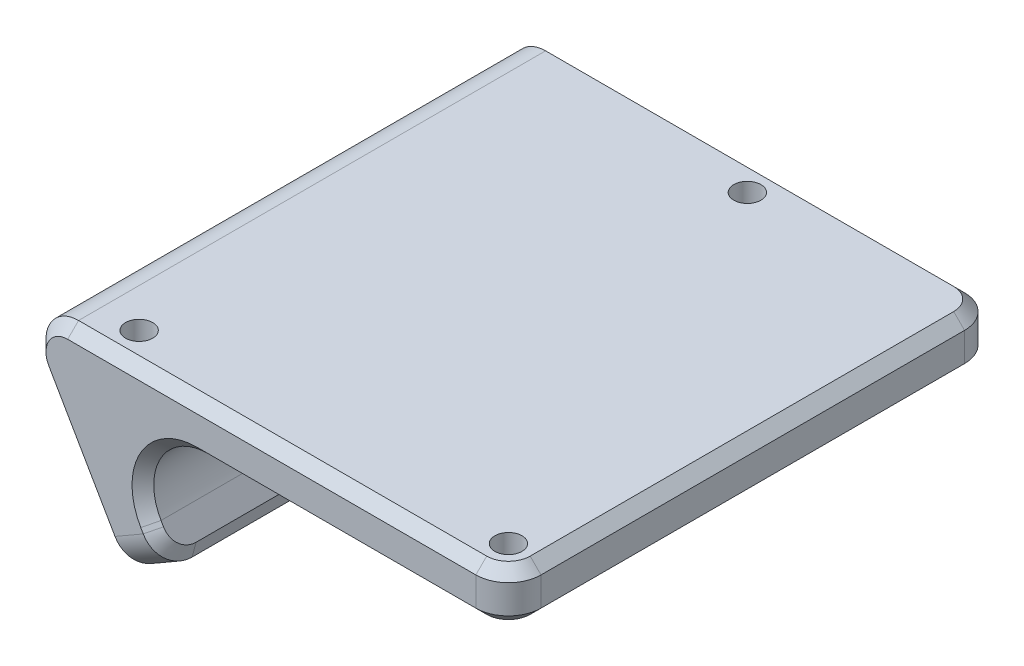
from build123d import *

# Parameters (mm, degrees)
EXTRUDE_1_DEPTH        = 45
FILLET_1_R             = 3
FILLET_2_R             = 5
FILLET_3_R             = 3
FILLET_4_R             = 3
CHAMFER_1_SIZE         = 1
HOLE_WIZARD_M3_1_D     = 2.5
HOLE_WIZARD_M3_1_DEPTH = 7.5
HOLE_WIZARD_M3_1_TIP   = 0.751075774
CHAMFER_2_SIZE         = 1
HOLE_WIZARD_M3_2_D     = 2.5
HOLE_WIZARD_M3_2_DEPTH = 7.5
HOLE_WIZARD_M3_2_TIP   = 0.751075774


with BuildPart() as part:
    # 草图1 → 凸台-拉伸1 (new body)
    with BuildSketch(Plane.XY):
        Polygon((40, 0), (-5.773502692, 0), (4.411675645, -17.641246358), (8.741802661, -15.141246359), (2.685178332, -4.650865298), (40, -4.650865298), align=None)
    extrude(amount=-EXTRUDE_1_DEPTH)

    # 圆角1
    fillet_1_edges = [part.edges().sort_by_distance(p)[0] for p in [
        (40, -2.325432649, -45),
        (40, -2.325432649, 0),
    ]]
    fillet(fillet_1_edges, radius=FILLET_1_R)

    # 圆角2
    fillet_2_edges = [part.edges().sort_by_distance(p)[0] for p in [
        (2.685178332, -4.650865298, -22.5),
    ]]
    fillet(fillet_2_edges, radius=FILLET_2_R)

    # 圆角3
    fillet_3_edges = [part.edges().sort_by_distance(p)[0] for p in [
        (-5.773502692, 0, -22.5),
    ]]
    fillet(fillet_3_edges, radius=FILLET_3_R)

    # 圆角4
    fillet_4_edges = [part.edges().sort_by_distance(p)[0] for p in [
        (6.576739153, -16.391246359, -45),
        (6.576739153, -16.391246359, 0),
    ]]
    fillet(fillet_4_edges, radius=FILLET_4_R)

    # 倒角1
    chamfer_1_edges = [part.edges().sort_by_distance(p)[0] for p in [
        (40, -4.650865298, -22.5),
        (24.172716185, -4.650865298, -45),
        (39.121320344, -4.650865298, -44.121320344),
        (39.121320344, -4.650865298, -0.878679656),
        (7.128554006, -12.347017723, -45),
        (24.172716185, -4.650865298, 0),
        (7.01530535, -7.150865298, 0),
        (7.01530535, -7.150865298, -45),
        (8.741802661, -15.141246359, -22.5),
        (7.128554006, -12.347017723, 0),
        (8.302462833, -14.380287455, -0.878679656),
        (8.302462833, -14.380287455, -44.121320344),
    ]]
    chamfer(chamfer_1_edges, length=CHAMFER_1_SIZE)

    # M3 螺纹孔1
    with Locations(Plane(origin=(0, 0, 0), x_dir=(1, 0, 0), z_dir=(0, 1, 0))):
        with Locations((20, 42), (3, 3), (37, 3)):
            Hole(HOLE_WIZARD_M3_1_D / 2, depth=HOLE_WIZARD_M3_1_DEPTH)
            with Locations((0, 0, -(HOLE_WIZARD_M3_1_DEPTH + HOLE_WIZARD_M3_1_TIP / 2))):  # 118° drill point
                Cone(0, HOLE_WIZARD_M3_1_D / 2, HOLE_WIZARD_M3_1_TIP, mode=Mode.SUBTRACT)

    # 倒角2
    chamfer_2_edges = [part.edges().sort_by_distance(p)[0] for p in [
        (18.211324866, 0, 0),
        (40, 0, -22.5),
        (39.121320344, 0, -44.121320344),
        (39.121320344, 0, -0.878679656),
        (18.211324866, 0, -45),
        (-0.131875417, -9.771585074, 0),
        (-3.17542648, -1.5, 0),
        (-3.17542648, -1.5, -45),
        (-0.131875417, -9.771585074, -45),
        (4.411675645, -17.641246358, -22.5),
        (3.972335817, -16.880287454, -0.878679656),
        (3.972335817, -16.880287454, -44.121320344),
    ]]
    chamfer(chamfer_2_edges, length=CHAMFER_2_SIZE)

    # M3 螺纹孔2
    with Locations(Plane(origin=(-4.330127018, -2.5, 0), x_dir=(0, 0, 1), z_dir=(-0.8660254037093238, -0.5000000001301026, 0))):
        with Locations((-38.625, -8.3965032), (-33.25, -4.3965032), (-27.875, -8.3965032), (-22.5, -12.3965032), (-17.125, -8.3965032), (-11.75, -4.3965032), (-6.375, -8.3965032)):
            Hole(HOLE_WIZARD_M3_2_D / 2, depth=HOLE_WIZARD_M3_2_DEPTH)
            with Locations((0, 0, -(HOLE_WIZARD_M3_2_DEPTH + HOLE_WIZARD_M3_2_TIP / 2))):  # 118° drill point
                Cone(0, HOLE_WIZARD_M3_2_D / 2, HOLE_WIZARD_M3_2_TIP, mode=Mode.SUBTRACT)


solid = part.part
